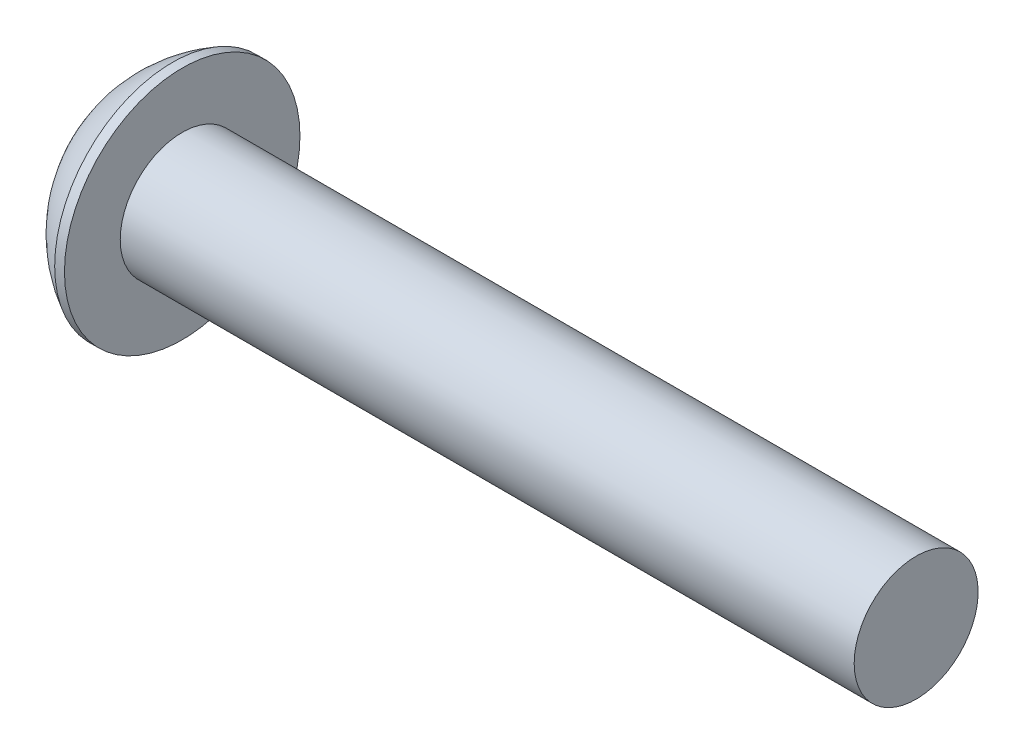
from build123d import *

# Parameters (mm, degrees)
CUT_EXTRUDE1_DEPTH = 1.8288


with BuildPart() as part:
    # Sketch1 → Revolve1 (revolve)
    with BuildSketch(Plane.XY, mode=Mode.PRIVATE) as revolve1_sk:
        with BuildLine():
            Line((0, 0), (29.3116, 0))
            Line((29.3116, 0), (29.3116, 2.413))
            Line((29.3116, 2.413), (0.7366, 2.413))
            Line((0.7366, 2.413), (0.7366, 4.5847))
            Line((0.7366, 4.5847), (0.3556, 4.5847))
            ThreePointArc((0.3556, 4.5847), (-0.901703741, 3.66491926), (-1.8288, 2.413))
            Line((-1.8288, 2.413), (-1.8288, 1.8288))
            Line((-1.8288, 1.8288), (0, 0))
        make_face()
    revolve(revolve1_sk.sketch.rotate(Axis((0, 0, 0), (1, 0, 0)), 90), axis=Axis((0, 0, 0), (1, 0, 0)))

    # Sketch2 → Cut-Extrude1 (cut)
    with BuildSketch(Plane.ZY.offset(1.8288)):
        Polygon((1.833087105, 0), (0.916543552, 1.5875), (-0.916543552, 1.5875), (-1.833087105, 0), (-0.916543552, -1.5875), (0.916543552, -1.5875), align=None)
    extrude(amount=-CUT_EXTRUDE1_DEPTH, mode=Mode.SUBTRACT)


solid = part.part
